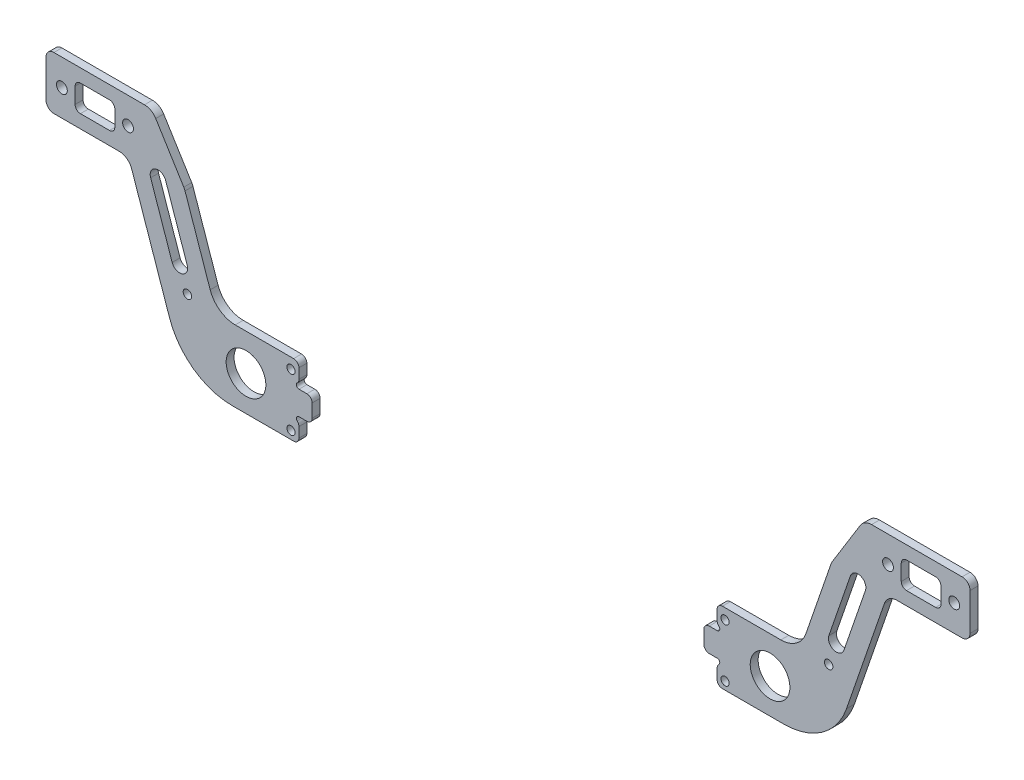
from build123d import *

# Parameters (mm, degrees)
SKETCH_1_W              = 196
SKETCH_1_H              = 49.67
EXTRUDE_1_DEPTH         = 3
EXTRUDE_2_DEPTH         = 3
FILLET_1_R              = 10
FILLET_2_R              = 3
SKETCH_4_R              = 2.1
CUT_EXTRUDE_2_DEPTH     = 4
FILLET_3_R              = 5
SKETCH_6_R              = 2.05
CUT_EXTRUDE_4_DEPTH     = 10
CUT_EXTRUDE_10_DEPTH    = 10
FILLET_7_R              = 2
SKETCH_13_W             = 6
SKETCH_13_H             = 20
EXTRUDE_3_DEPTH         = 3
FILLET_9_R              = 10
FILLET_10_R             = 2
SKETCH_14_R             = 1.55
CUT_EXTRUDE_12_DEPTH    = 10
SKETCH_21_W             = 16
SKETCH_21_H             = 22
CUT_EXTRUDE_16_DEPTH    = 10
EXTRUDE_START           = -3
SKETCH_22_R             = 1.55
EXTRUDE_5_DEPTH         = 3
FILLET_13_R             = 10
FILLET_13_OF_MIRROR_9_R = 10
SKETCH_25_W             = 15
SKETCH_25_H             = 10
CUT_EXTRUDE_18_DEPTH    = 10
CUT_EXTRUDE_19_DEPTH    = 5
EXTRUDE_7_DEPTH         = 3
SKETCH_28_R             = 1.55
CUT_EXTRUDE_20_DEPTH    = 3
SKETCH_29_R             = 1
SKETCH_29_W             = 5
SKETCH_29_H             = 9
CUT_EXTRUDE_21_DEPTH    = 5
SKETCH_30_R             = 1.6
CUT_EXTRUDE_22_DEPTH    = 10
FILLET_15_R             = 2
SKETCH_31_R             = 7.5
CUT_EXTRUDE_23_DEPTH    = 10
FILLET_16_R             = 2


with BuildPart() as part:
    # 草图1 → 凸台-拉伸1 (new body)
    with BuildSketch(Plane.XY):
        Rectangle(SKETCH_1_W, SKETCH_1_H)
    extrude(amount=EXTRUDE_1_DEPTH)

    # 草图2 → 凸台-拉伸2 (add)
    with BuildSketch(Plane.XY.offset(3)):
        Polygon((98, 24.835), (114, 24.835), (122.222543405, 48.715), (134.566612912, 68.715), (174.566612912, 68.715), (174.566612912, 48.715), (143.374957029, 48.715), (128.265861358, 4.835), (98, 4.835), align=None)
        Polygon((-98, 24.835), (-98, 4.835), (-128.265861358, 4.835), (-143.374957029, 48.715), (-174.566612912, 48.715), (-174.566612912, 68.715), (-134.566612912, 68.715), (-122.222543405, 48.715), (-114, 24.835), align=None)
    extrude(amount=-EXTRUDE_2_DEPTH)

    # 圆角1
    fillet_1_edges = [part.edges().sort_by_distance(p)[0] for p in [
        (128.265861358, 4.835, 1.5),
        (114, 24.835, 1.5),
        (-128.265861358, 4.835, 1.5),
        (-114, 24.835, 1.5),
    ]]
    fillet(fillet_1_edges, radius=FILLET_1_R)

    # 圆角2
    fillet_2_edges = [part.edges().sort_by_distance(p)[0] for p in [
        (174.566612912, 48.715, 1.5),
        (174.566612912, 68.715, 1.5),
        (-174.566612912, 68.715, 1.5),
        (-174.566612912, 48.715, 1.5),
        (98, -24.835, 1.5),
        (-98, -24.835, 1.5),
    ]]
    fillet(fillet_2_edges, radius=FILLET_2_R)

    # 草图4 → 切除-拉伸2 (cut)
    with BuildSketch(Plane.XY.offset(3)):
        with Locations((47.5, -7.338706147)):
            Circle(SKETCH_4_R)
        with Locations((47.5, 17.661293853)):
            Circle(SKETCH_4_R)
        with Locations((-47.5, 17.661293853)):
            Circle(SKETCH_4_R)
        with Locations((-47.5, -7.338706147)):
            Circle(SKETCH_4_R)
    extrude(amount=-CUT_EXTRUDE_2_DEPTH, mode=Mode.SUBTRACT)

    # 圆角3
    fillet_3_edges = [part.edges().sort_by_distance(p)[0] for p in [
        (143.374957029, 48.715, 1.5),
        (134.566612912, 68.715, 1.5),
        (122.222543405, 48.715, 1.5),
        (-122.222543405, 48.715, 1.5),
        (-134.566612912, 68.715, 1.5),
        (-143.374957029, 48.715, 1.5),
    ]]
    fillet(fillet_3_edges, radius=FILLET_3_R)

    # 草图6 → 切除-拉伸4 (cut)
    with BuildSketch(Plane.XY.offset(3)):
        with Locations((-168.566612912, 58.715)):
            Circle(SKETCH_6_R)
        with Locations((-143.566612912, 58.715)):
            Circle(SKETCH_6_R)
        with Locations(Location((143.566612912, 58.715, 0), (0, 0, 180))):
            Circle(SKETCH_6_R)
        with Locations(Location((168.566612912, 58.715, 0), (0, 0, 180))):
            Circle(SKETCH_6_R)
    extrude(amount=-CUT_EXTRUDE_4_DEPTH, mode=Mode.SUBTRACT)

    # 草图10 → 切除-拉伸10 (cut)
    with BuildSketch(Plane.XY.offset(3)):
        Polygon((0, 3.310312062), (-34.285062119, -17.835), (34.285062119, -17.835), align=None)
        Polygon((-40, 18.835), (-40, -14.310312062), (-3, 8.509437938), (-3, 18.835), align=None)
        Polygon((3, 8.509437938), (40, -14.310312062), (40, 18.835), (3, 18.835), align=None)
    extrude(amount=-CUT_EXTRUDE_10_DEPTH, mode=Mode.SUBTRACT)

    # 圆角7
    fillet_7_edges = [part.edges().sort_by_distance(p)[0] for p in [
        (3, 8.509437938, 1.5),
        (3, 18.835, 1.5),
        (40, 18.835, 1.5),
        (40, -14.310312062, 1.5),
        (-3, 8.509437938, 1.5),
        (-40, -14.310312062, 1.5),
        (-40, 18.835, 1.5),
        (-3, 18.835, 1.5),
        (0, 3.310312062, 1.5),
        (34.285062119, -17.835, 1.5),
        (-34.285062119, -17.835, 1.5),
    ]]
    fillet(fillet_7_edges, radius=FILLET_7_R)

    # 草图13 → 凸台-拉伸3 (add)
    with BuildSketch(Plane.XY.offset(3)):
        with Locations((-101, -5.165)):
            Rectangle(SKETCH_13_W, SKETCH_13_H)
    extrude_3 = extrude(amount=-EXTRUDE_3_DEPTH)

    # 镜向3: 凸台-拉伸3 across plane
    add(extrude_3.mirror(Plane(origin=(0, 0, 0), x_dir=(0, 0, 1), z_dir=(1, 0, 0))))

    # 圆角9
    fillet_9_edges = [part.edges().sort_by_distance(p)[0] for p in [
        (-104, 4.835, 1.5),
        (104, 4.835, 1.5),
    ]]
    fillet(fillet_9_edges, radius=FILLET_9_R)

    # 圆角10
    fillet_10_edges = [part.edges().sort_by_distance(p)[0] for p in [
        (-104, -15.165, 1.5),
        (-98, -15.165, 1.5),
        (98, -15.165, 1.5),
        (104, -15.165, 1.5),
    ]]
    fillet(fillet_10_edges, radius=FILLET_10_R)

    # 草图14 → 切除-拉伸12 (cut)
    with BuildSketch(Plane(origin=(0, 0, 0), x_dir=(-1, 0, 0), z_dir=(0, 0, -1))):
        with Locations((104, 9.835)):
            Circle(SKETCH_14_R)
        with Locations((104, -10.165)):
            Circle(SKETCH_14_R)
    cut_extrude_12 = extrude(amount=-CUT_EXTRUDE_12_DEPTH, mode=Mode.SUBTRACT)

    # 镜向4: 切除-拉伸12 across plane
    add(cut_extrude_12.mirror(Plane(origin=(0, 0, 0), x_dir=(0, 0, 1), z_dir=(1, 0, 0))), mode=Mode.SUBTRACT)

    # 草图21 → 切除-拉伸16 (cut)
    with BuildSketch(Plane.XY.offset(3)):
        with Locations((-106, -6.165)):
            Rectangle(SKETCH_21_W, SKETCH_21_H)
    cut_extrude_16 = extrude(amount=-CUT_EXTRUDE_16_DEPTH, mode=Mode.SUBTRACT)

    # 草图22 → 凸台-拉伸5 (add)
    with BuildSketch(Plane.XY.offset(3).offset(EXTRUDE_START)):
        with Locations((-104, 9.835)):
            Circle(SKETCH_22_R)
    extrude_5 = extrude(amount=EXTRUDE_5_DEPTH)

    # 圆角13
    fillet_13_edges = [part.edges().sort_by_distance(p)[0] for p in [
        (-98, 4.835, 1.5),
    ]]
    fillet(fillet_13_edges, radius=FILLET_13_R)

    # 镜向9: 切除-拉伸16, 凸台-拉伸5 across plane
    add(cut_extrude_16.mirror(Plane(origin=(0, 0, 0), x_dir=(0, 0, 1), z_dir=(1, 0, 0))), mode=Mode.SUBTRACT)
    add(extrude_5.mirror(Plane(origin=(0, 0, 0), x_dir=(0, 0, 1), z_dir=(1, 0, 0))))

    # 圆角13 of 镜向9
    fillet_13_of_mirror_9_edges = [part.edges().sort_by_distance(p)[0] for p in [
        (98, 4.835, 1.5),
    ]]
    fillet(fillet_13_of_mirror_9_edges, radius=FILLET_13_OF_MIRROR_9_R)

    # 草图25 → 切除-拉伸18 (cut)
    with BuildSketch(Plane.XY.offset(3)):
        with Locations((-156.066612912, 58.715)):
            Rectangle(SKETCH_25_W, SKETCH_25_H)
        with Locations((156.066612912, 58.715)):
            Rectangle(SKETCH_25_W, SKETCH_25_H)
    extrude(amount=-CUT_EXTRUDE_18_DEPTH, mode=Mode.SUBTRACT)

    # 草图26 → 切除-拉伸19 (cut, symmetric)
    with BuildSketch(Plane.XY.offset(3)):
        Polygon((74, 13.835), (98, 13.835), (98, 24.835), (-98, 24.835), (-98, 13.835), (-74, 13.835), (-74, -13.165), (-98, -13.165), (-98, -35), (98, -35), (98, -13.165), (74, -13.165), align=None)
        with BuildLine():
            Line((110.212396254, 13.835), (116.322255077, 31.579318455))
            ThreePointArc((116.322255077, 31.579318455), (112.674098878, 26.693844816), (106.867069321, 24.835))
            Line((106.867069321, 24.835), (98, 24.835))
            Line((98, 24.835), (98, 13.835))
            Line((98, 13.835), (110.212396254, 13.835))
        make_face()
        with BuildLine():
            Line((-98, 13.835), (-98, 24.835))
            Line((-98, 24.835), (-106.867069321, 24.835))
            ThreePointArc((-106.867069321, 24.835), (-112.674098878, 26.693844816), (-116.322255077, 31.579318455))
            Line((-116.322255077, 31.579318455), (-110.212396254, 13.835))
            Line((-110.212396254, 13.835), (-98, 13.835))
        make_face()
    extrude(amount=CUT_EXTRUDE_19_DEPTH, both=True, mode=Mode.SUBTRACT)


with BuildPart() as cut_extrude_19_piece_1:
    # of the separate pieces the step leaves, piece 1, a body of its own (cut_extrude_19_pieces)
    add(part.part.solids().sort_by_distance((98, -13.165, 3))[0])



with BuildPart() as cut_extrude_19_piece_2:
    # of the separate pieces the step leaves, piece 2, a body of its own (cut_extrude_19_pieces)
    add(part.part.solids().sort_by_distance((-98, -5.165, 3))[0])


with BuildPart() as cut_extrude_19_piece_1_1:
    add(cut_extrude_19_piece_1.part)

    add(cut_extrude_19_piece_2.part)  # 凸台-拉伸7 merges 切除-拉伸19 piece 2
    # 草图27 → 凸台-拉伸7 (add)
    with BuildSketch(Plane.XY.offset(3)):
        with BuildLine():
            Line((116.322255077, 31.579318455), (112.534651331, 20.579318455))
            ThreePointArc((112.534651331, 20.579318455), (108.886495132, 15.693844816), (103.079465575, 13.835))
            Line((103.079465575, 13.835), (74, 13.835))
            Line((74, 13.835), (74, -13.165))
            Line((74, -13.165), (104.235637621, -13.165))
            ThreePointArc((104.235637621, -13.165), (118.753211514, -8.517887959), (127.873602011, 3.695796139))
            Line((127.873602011, 3.695796139), (130.588116435, 11.579318455))
            Line((130.588116435, 11.579318455), (116.322255077, 31.579318455))
        make_face()
        with BuildLine():
            Line((-130.588116435, 11.579318455), (-127.873602011, 3.695796139))
            ThreePointArc((-127.873602011, 3.695796139), (-118.753211514, -8.517887959), (-104.235637621, -13.165))
            Line((-104.235637621, -13.165), (-74, -13.165))
            Line((-74, -13.165), (-74, 13.835))
            Line((-74, 13.835), (-103.079465575, 13.835))
            ThreePointArc((-103.079465575, 13.835), (-108.886495132, 15.693844816), (-112.534651331, 20.579318455))
            Line((-112.534651331, 20.579318455), (-116.322255077, 31.579318455))
            Line((-116.322255077, 31.579318455), (-130.588116435, 11.579318455))
        make_face()
    extrude(amount=-EXTRUDE_7_DEPTH)

    # 草图28 → 切除-拉伸20 (cut)
    with BuildSketch(Plane.XY.offset(3)):
        with Locations((82, 9.835)):
            Circle(SKETCH_28_R)
        with Locations((82, -10.165)):
            Circle(SKETCH_28_R)
        with Locations(Location((-82, 9.835, 0), (0, 0, 180))):
            Circle(SKETCH_28_R)
        with Locations(Location((-82, -10.165, 0), (0, 0, 180))):
            Circle(SKETCH_28_R)
    extrude(amount=-CUT_EXTRUDE_20_DEPTH, mode=Mode.SUBTRACT)

    # 草图29 → 切除-拉伸21 (cut)
    with BuildSketch(Plane.XY.offset(3)):
        with BuildLine():
            Line((79, -4.165), (74, -4.165))
            Line((74, -4.165), (74, -13.165))
            Line((74, -13.165), (79, -13.165))
            Line((79, -13.165), (79, -6.165))
            ThreePointArc((79, -6.165), (78, -5.165), (79, -4.165))
        make_face()
        with BuildLine():
            ThreePointArc((80, -5.165), (79.707106781, -4.457893219), (79, -4.165))
            Line((79, -4.165), (79, -6.165))
            ThreePointArc((79, -6.165), (79.707106781, -5.872106781), (80, -5.165))
        make_face()
        with BuildLine():
            Line((79, -6.165), (79, -4.165))
            ThreePointArc((79, -4.165), (78, -5.165), (79, -6.165))
        make_face()
        with BuildLine():
            Line((79, 13.835), (74, 13.835))
            Line((74, 13.835), (74, 4.835))
            Line((74, 4.835), (79, 4.835))
            ThreePointArc((79, 4.835), (78, 5.835), (79, 6.835))
            Line((79, 6.835), (79, 13.835))
        make_face()
        with BuildLine():
            ThreePointArc((80, 5.835), (79.707106781, 6.542106781), (79, 6.835))
            Line((79, 6.835), (79, 4.835))
            ThreePointArc((79, 4.835), (79.707106781, 5.127893219), (80, 5.835))
        make_face()
        with BuildLine():
            Line((79, 4.835), (79, 6.835))
            ThreePointArc((79, 6.835), (78, 5.835), (79, 4.835))
        make_face()
        with Locations((-79, 5.835)):
            Circle(SKETCH_29_R)
        with Locations((-76.5, 9.335)):
            Rectangle(SKETCH_29_W, SKETCH_29_H)
        with BuildLine():
            ThreePointArc((-78, 5.835), (-78.292893219, 6.542106781), (-79, 6.835))
            Line((-79, 6.835), (-79, 4.835))
            ThreePointArc((-79, 4.835), (-78.292893219, 5.127893219), (-78, 5.835))
        make_face()
        with BuildLine():
            Line((-79, 4.835), (-79, 6.835))
            ThreePointArc((-79, 6.835), (-80, 5.835), (-79, 4.835))
        make_face()
        with BuildLine():
            ThreePointArc((-79, -4.165), (-80, -5.165), (-79, -6.165))
            Line((-79, -6.165), (-79, -4.165))
        make_face()
        with BuildLine():
            Line((-79, -4.165), (-79, -6.165))
            ThreePointArc((-79, -6.165), (-78.292893219, -5.872106781), (-78, -5.165))
            ThreePointArc((-78, -5.165), (-78.292893219, -4.457893219), (-79, -4.165))
        make_face()
        with Locations((-79, -5.165)):
            Circle(SKETCH_29_R)
        with Locations((-76.5, -8.665)):
            Rectangle(SKETCH_29_W, SKETCH_29_H)
    extrude(amount=-CUT_EXTRUDE_21_DEPTH, mode=Mode.SUBTRACT)

    # 草图30 → 切除-拉伸22 (cut)
    with BuildSketch(Plane(origin=(0, 0, 0), x_dir=(-1, 0, 0), z_dir=(0, 0, -1))):
        with Locations((121.132930679, 14.835)):
            Circle(SKETCH_30_R)
        with Locations((-121.132930679, 14.835)):
            Circle(SKETCH_30_R)
    extrude(amount=-CUT_EXTRUDE_22_DEPTH, mode=Mode.SUBTRACT)

    # 圆角15
    fillet_15_edges = [cut_extrude_19_piece_1_1.edges().sort_by_distance(p)[0] for p in [
        (-148.566612912, 63.715, 1.5),
        (-148.566612912, 53.715, 1.5),
        (-163.566612912, 53.715, 1.5),
        (-163.566612912, 63.715, 1.5),
        (-79, 13.835, 1.5),
        (-74, -4.165, 1.5),
        (-79, 6.835, 1.5),
        (-74, 4.835, 1.5),
        (-79, -6.165, 1.5),
        (-79, -13.165, 1.5),
    ]]
    fillet(fillet_15_edges, radius=FILLET_15_R)

    # 草图31 → 切除-拉伸23 (cut)
    with BuildSketch(Plane.XY.offset(3)):
        with Locations((-99, 0)):
            Circle(SKETCH_31_R)
        with Locations(Location((99, 0, 0), (0, 0, 180))):
            Circle(SKETCH_31_R)
        with BuildLine():
            Line((-129.365692204, 47.959336034), (-121.226488342, 24.321371644))
            ThreePointArc((-121.226488342, 24.321371644), (-123.086339606, 20.508111454), (-126.899599796, 22.367962717))
            Line((-126.899599796, 22.367962717), (-135.038803657, 46.005927107))
            ThreePointArc((-135.038803657, 46.005927107), (-133.178952394, 49.819187297), (-129.365692204, 47.959336034))
        make_face()
        with BuildLine():
            Line((129.365692204, 47.959336034), (121.226488342, 24.321371644))
            ThreePointArc((121.226488342, 24.321371644), (123.086339606, 20.508111454), (126.899599796, 22.367962717))
            Line((126.899599796, 22.367962717), (135.038803657, 46.005927107))
            ThreePointArc((135.038803657, 46.005927107), (133.178952394, 49.819187297), (129.365692204, 47.959336034))
        make_face()
    extrude(amount=-CUT_EXTRUDE_23_DEPTH, mode=Mode.SUBTRACT)

    # 圆角16
    fillet_16_edges = [cut_extrude_19_piece_1_1.edges().sort_by_distance(p)[0] for p in [
        (79, -13.165, 1.5),
        (74, 4.835, 1.5),
        (79, -6.165, 1.5),
        (74, -4.165, 1.5),
        (79, 13.835, 1.5),
        (79, 6.835, 1.5),
        (163.566612912, 53.715, 1.5),
        (148.566612912, 53.715, 1.5),
        (148.566612912, 63.715, 1.5),
        (163.566612912, 63.715, 1.5),
    ]]
    fillet(fillet_16_edges, radius=FILLET_16_R)


solid = cut_extrude_19_piece_1_1.part
